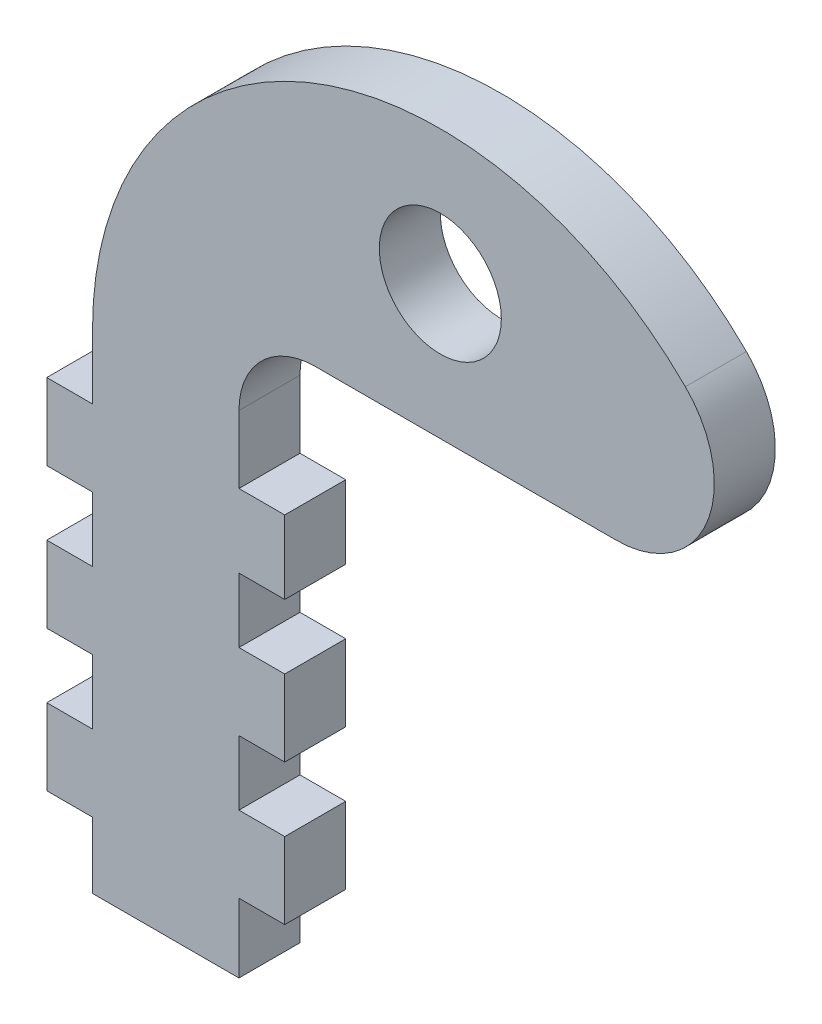
from build123d import *

# Parameters (mm, degrees)
SKETCH_1_R      = 4
EXTRUDE_1_DEPTH = 4


with BuildPart() as part:
    # 草图1 → 凸台-拉伸1 (new body)
    with BuildSketch(Plane.XY):
        with BuildLine():
            ThreePointArc((34.064306358, 2.179556892), (9.237186096, 7.048826392), (-4.8, -14))
            Line((-4.8, -14), (-4.8, -18.23))
            Line((-4.8, -18.23), (-7.8, -18.23))
            Line((-7.8, -18.23), (-7.8, -23.23))
            Line((-7.8, -23.23), (-4.8, -23.23))
            Line((-4.8, -23.23), (-4.8, -27.46))
            Line((-4.8, -27.46), (-7.8, -27.46))
            Line((-7.8, -27.46), (-7.8, -32.46))
            Line((-7.8, -32.46), (-4.8, -32.46))
            Line((-4.8, -32.46), (-4.8, -36.69))
            Line((-4.8, -36.69), (-7.8, -36.69))
            Line((-7.8, -36.69), (-7.8, -41.69))
            Line((-7.8, -41.69), (-4.8, -41.69))
            Line((-4.8, -41.69), (-4.8, -46.02))
            Line((-4.8, -46.02), (4.8, -46.02))
            Line((4.8, -46.02), (4.8, -41.49))
            Line((4.8, -41.49), (7.8, -41.49))
            Line((7.8, -41.49), (7.8, -36.49))
            Line((7.8, -36.49), (4.8, -36.49))
            Line((4.8, -36.49), (4.8, -32.26))
            Line((4.8, -32.26), (7.8, -32.26))
            Line((7.8, -32.26), (7.8, -27.26))
            Line((7.8, -27.26), (4.8, -27.26))
            Line((4.8, -27.26), (4.8, -23.03))
            Line((4.8, -23.03), (7.8, -23.03))
            Line((7.8, -23.03), (7.8, -18.23))
            Line((7.8, -18.23), (4.8, -18.23))
            Line((4.8, -18.23), (4.8, -13.8))
            ThreePointArc((4.8, -13.8), (6.264466094, -10.264466094), (9.8, -8.8))
            Line((9.8, -8.8), (18, -8.8))
            Line((18, -8.8), (29.480940848, -8.8))
            ThreePointArc((29.480940848, -8.8), (35.465961002, -4.851988259), (34.064306358, 2.179556892))
        make_face()
        with Locations((18, 0)):
            Circle(SKETCH_1_R, mode=Mode.SUBTRACT)
    extrude(amount=EXTRUDE_1_DEPTH)


solid = part.part
